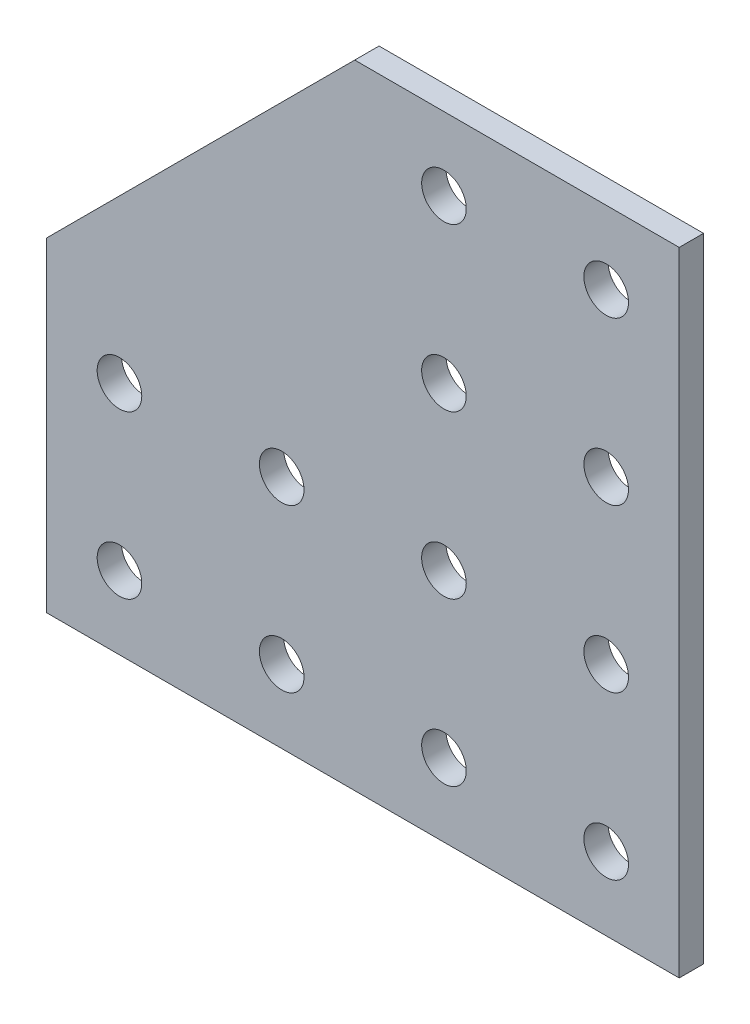
from build123d import *

# Parameters (mm, degrees)
ESQUISSE1_R        = 2.75
BOSS_EXTRU_1_DEPTH = 3


with BuildPart() as part:
    # Esquisse1 → Boss.-Extru.1 (new body)
    with BuildSketch(Plane.XY):
        Polygon((0, 0), (0, 40), (38, 78), (78, 78), (78, 0), align=None)
        with Locations((9, 29)):
            Circle(ESQUISSE1_R, mode=Mode.SUBTRACT)
        with Locations(Location((9, 9, 0), (0, 0, 180))):
            Circle(ESQUISSE1_R, mode=Mode.SUBTRACT)
        with Locations((29, 9)):
            Circle(ESQUISSE1_R, mode=Mode.SUBTRACT)
        with Locations(Location((29, 29, 0), (0, 0, 180))):
            Circle(ESQUISSE1_R, mode=Mode.SUBTRACT)
        with Locations((49, 29)):
            Circle(ESQUISSE1_R, mode=Mode.SUBTRACT)
        with Locations(Location((49, 9, 0), (0, 0, 180))):
            Circle(ESQUISSE1_R, mode=Mode.SUBTRACT)
        with Locations((69, 9)):
            Circle(ESQUISSE1_R, mode=Mode.SUBTRACT)
        with Locations((69, 29)):
            Circle(ESQUISSE1_R, mode=Mode.SUBTRACT)
        with Locations((49, 49)):
            Circle(ESQUISSE1_R, mode=Mode.SUBTRACT)
        with Locations(Location((69, 49, 0), (0, 0, 180))):
            Circle(ESQUISSE1_R, mode=Mode.SUBTRACT)
        with Locations((69, 69)):
            Circle(ESQUISSE1_R, mode=Mode.SUBTRACT)
        with Locations(Location((49, 69, 0), (0, 0, 180))):
            Circle(ESQUISSE1_R, mode=Mode.SUBTRACT)
    extrude(amount=BOSS_EXTRU_1_DEPTH)


solid = part.part
